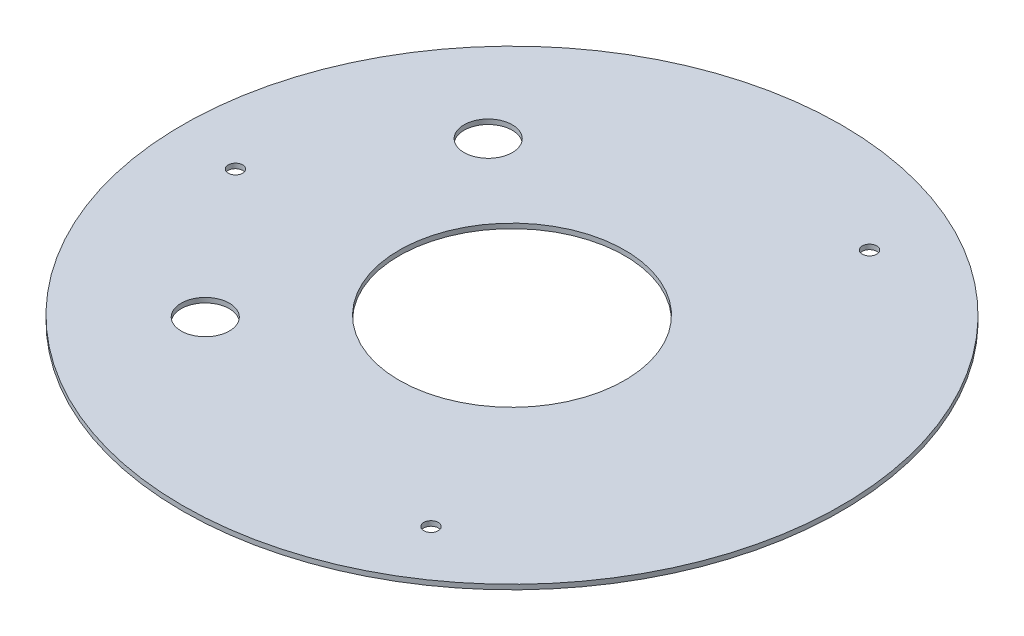
from build123d import *

# Parameters (mm, degrees)
SKETCH1_R           = 68.369999998
SKETCH1_R_2         = 23.401
BOSS_EXTRUDE1_DEPTH = 1
SKETCH2_R           = 1.5
CUT_EXTRUDE1_DEPTH  = 10
SKETCH6_R           = 5
CUT_EXTRUDE2_DEPTH  = 10


with BuildPart() as part:
    # Sketch1 → Boss-Extrude1 (new body)
    with BuildSketch(Plane(origin=(0, 0, 0), x_dir=(-1, 0, 0), z_dir=(0, 1, 0))):
        with Locations(Location((-73.249601195, 33.216650322, 0), (0, 0, 90))):
            Circle(SKETCH1_R)
        with Locations(Location((-73.249601195, 33.216650322, 0), (0, 0, 90))):
            Circle(SKETCH1_R_2, mode=Mode.SUBTRACT)
    extrude(amount=BOSS_EXTRUDE1_DEPTH)

    # Sketch2 → Cut-Extrude1 (cut)
    with BuildSketch(Plane.XZ.offset(-1)):
        with Locations(Location((18.303061139, 35.641054554, 0), (0, 0, 90))):
            Circle(SKETCH2_R)
        with Locations(Location((102.822466876, 79.589547745, 0), (0, 0, 90))):
            Circle(SKETCH2_R)
        with Locations(Location((98.623275569, -15.580651332, 0), (0, 0, 90))):
            Circle(SKETCH2_R)
    extrude(amount=CUT_EXTRUDE1_DEPTH, mode=Mode.SUBTRACT)

    # Sketch6 → Cut-Extrude2 (cut)
    with BuildSketch(Plane(origin=(47.341973048, -2, 109.358916756), x_dir=(0.09761667308977556, 0, 0.995224087899245), z_dir=(0, -1, 0))):
        with Locations(Location((-105.702188225, -2.042468777, 0), (0, 0, 5.601944352))):
            Circle(SKETCH6_R)
        with Locations(Location((-44.324158759, 1.255349618, 0), (0, 0, 5.601944352))):
            Circle(SKETCH6_R)
    extrude(amount=-CUT_EXTRUDE2_DEPTH, mode=Mode.SUBTRACT)


solid = part.part
